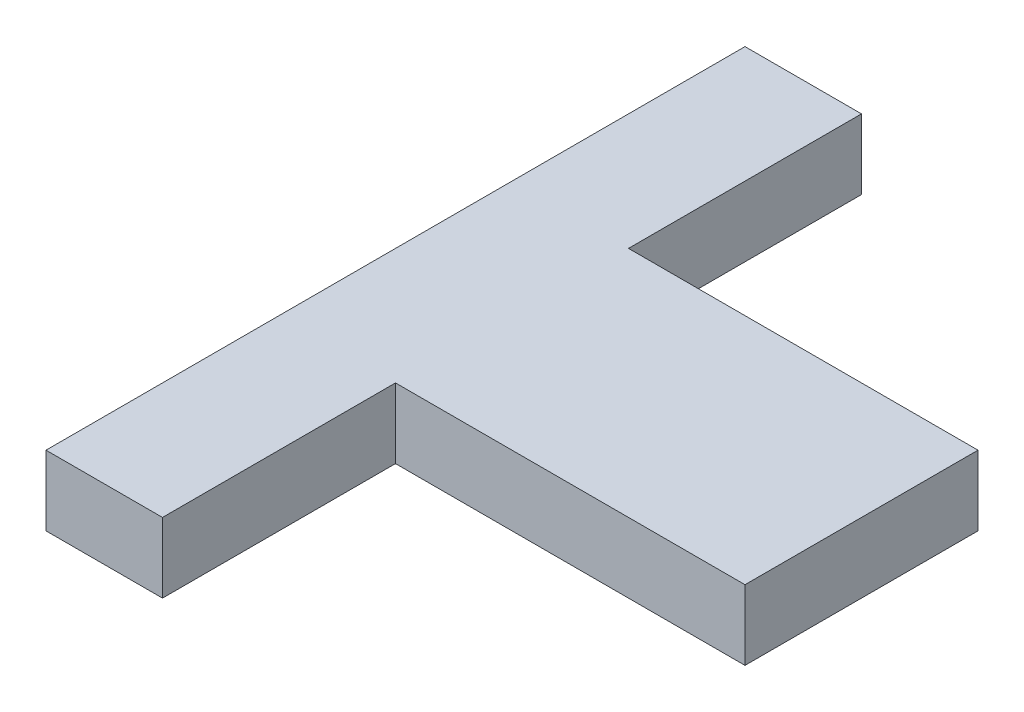
from build123d import *

# Parameters (mm, degrees)
SKETCH1_W           = 10
SKETCH1_H           = 60
SKETCH1_W_2         = 30
SKETCH1_H_2         = 20
BOSS_EXTRUDE1_DEPTH = 6


with BuildPart() as part:
    # Sketch1 → Boss-Extrude1 (new body)
    with BuildSketch(Plane(origin=(0, 0, 0), x_dir=(1, 0, 0), z_dir=(0, 1, 0))):
        with Locations((5, -30)):
            Rectangle(SKETCH1_W, SKETCH1_H)
        with Locations((25, -30)):
            Rectangle(SKETCH1_W_2, SKETCH1_H_2)
    extrude(amount=BOSS_EXTRUDE1_DEPTH)


solid = part.part
